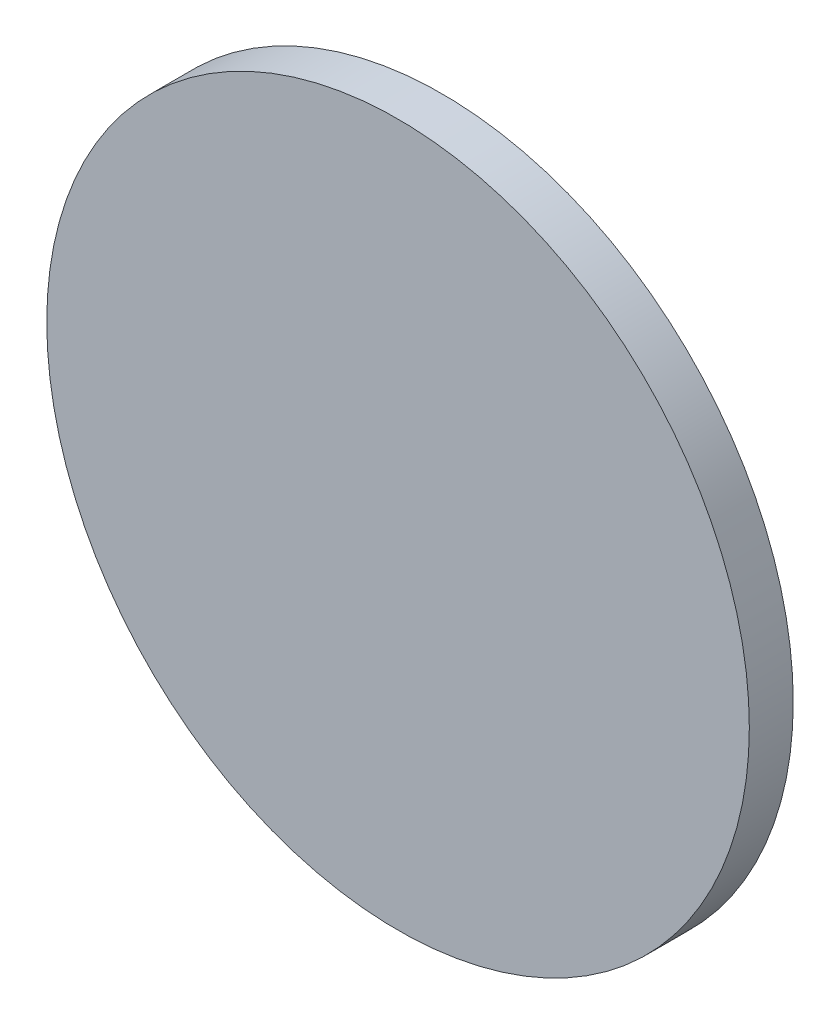
from build123d import *

# Parameters (mm, degrees)
SKETCH1_R           = 24
BOSS_EXTRUDE1_DEPTH = 3


with BuildPart() as part:
    # Sketch1 → Boss-Extrude1 (new body)
    with BuildSketch(Plane.XY):
        Circle(SKETCH1_R)
    extrude(amount=BOSS_EXTRUDE1_DEPTH)


solid = part.part
